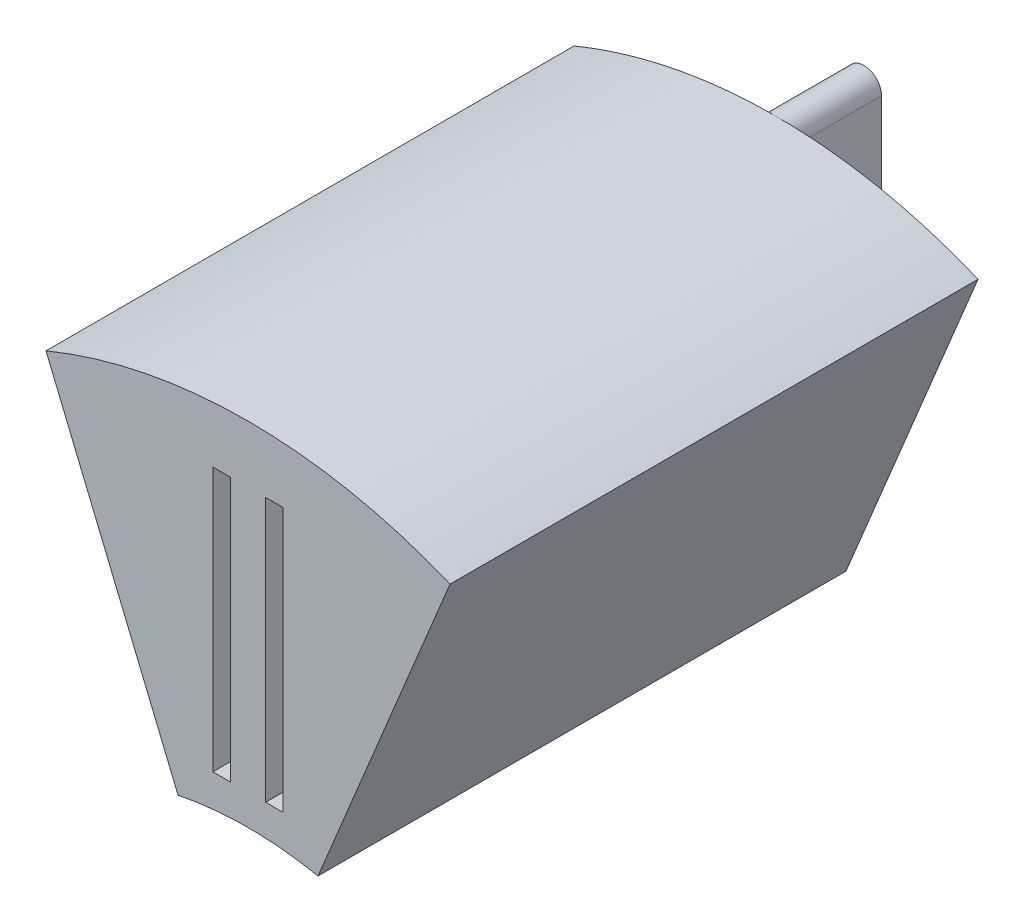
from build123d import *

# Parameters (mm, degrees)
BOSS_EXTRUDE1_DEPTH     = 3
BOSS_EXTRUDE2_DEPTH     = 0.5
CUT_EXTRUDE1_DEPTH      = 0.1
CUT_EXTRUDE1_DEPTH_BACK = 0.3
SKETCH5_W               = 0.2
SKETCH5_H               = 1.5
BOSS_EXTRUDE3_DEPTH     = 3
BOSS_EXTRUDE4_START     = 0.5
BOSS_EXTRUDE4_DEPTH     = 0.5
SKETCH7_R               = 2
CUT_EXTRUDE2_DEPTH      = 3
SKETCH8_W               = 2.825057403
SKETCH8_H               = 1.13922334
CUT_EXTRUDE3_DEPTH      = 0.5
SKETCH9_W               = 2.979299044
SKETCH9_H               = 1.350290847
CUT_EXTRUDE4_DEPTH      = 0.5
SKETCH10_W              = 0.979929186
SKETCH10_H              = 2.841384628
CUT_EXTRUDE5_DEPTH      = 2


with BuildPart() as part:
    # Sketch1 → Boss-Extrude1 (new body)
    with BuildSketch(Plane.XY):
        with BuildLine():
            Line((1.148050297, 2.771638598), (0.382683432, 0.923879533))
            ThreePointArc((0.382683432, 0.923879533), (0, 1), (-0.382683432, 0.923879533))
            Line((-0.382683432, 0.923879533), (-1.148050297, 2.771638598))
            ThreePointArc((-1.148050297, 2.771638598), (0, 3), (1.148050297, 2.771638598))
        make_face()
    extrude(amount=BOSS_EXTRUDE1_DEPTH)

    # Sketch2 → Boss-Extrude2 (add)
    with BuildSketch(Plane.XY.offset(3)):
        with BuildLine():
            Line((-0.1, 2), (-0.1, 2.9))
            ThreePointArc((-0.1, 2.9), (0, 3), (0.1, 2.9))
            Line((0.1, 2.9), (0.1, 2))
            ThreePointArc((0.1, 2), (0, 1.9), (-0.1, 2))
        make_face()
    extrude(amount=BOSS_EXTRUDE2_DEPTH)

    # Sketch4 → Cut-Extrude1 (cut, two sides: drawn at the far end of the back side and taken through both)
    with BuildSketch(Plane(origin=(0.1, 0, 0), x_dir=(0, 0, -1), z_dir=(1, 0, 0)).offset(-CUT_EXTRUDE1_DEPTH_BACK)):
        Polygon((-3, 2.673879533), (-3, 1.173879533), (-1, 1.173879533), align=None)
    extrude(amount=CUT_EXTRUDE1_DEPTH + CUT_EXTRUDE1_DEPTH_BACK, mode=Mode.SUBTRACT)

    # Sketch5 → Boss-Extrude3 (add)
    with BuildSketch(Plane.XY.offset(3)):
        with Locations((0, 1.923879533)):
            Rectangle(SKETCH5_W, SKETCH5_H)
    extrude(amount=-BOSS_EXTRUDE3_DEPTH)

    # Sketch6 → Boss-Extrude4 (add)
    with BuildSketch(Plane(origin=(0, 0, 0), x_dir=(-1, 0, 0), z_dir=(0, 0, -1)).offset(BOSS_EXTRUDE4_START)):
        with BuildLine():
            Line((-0.1, 2), (-0.1, 2.9))
            ThreePointArc((-0.1, 2.9), (0, 3), (0.1, 2.9))
            Line((0.1, 2.9), (0.1, 2))
            ThreePointArc((0.1, 2), (0, 1.9), (-0.1, 2))
        make_face()
    extrude(amount=-BOSS_EXTRUDE4_DEPTH)

    # Sketch7 → Cut-Extrude2 (cut)
    with BuildSketch(Plane.XY.offset(3)):
        with Locations((0, -1)):
            Circle(SKETCH7_R)
    extrude(amount=-CUT_EXTRUDE2_DEPTH, mode=Mode.SUBTRACT)

    # Sketch8 → Cut-Extrude3 (cut)
    with BuildSketch(Plane.XY.offset(3.5)):
        with Locations((0.108239748, 1.43038833)):
            Rectangle(SKETCH8_W, SKETCH8_H)
    extrude(amount=-CUT_EXTRUDE3_DEPTH, mode=Mode.SUBTRACT)

    # Sketch9 → Cut-Extrude4 (cut)
    with BuildSketch(Plane(origin=(0, 0, -0.5), x_dir=(-1, 0, 0), z_dir=(0, 0, -1))):
        with Locations((-0.058178864, 1.324854576)):
            Rectangle(SKETCH9_W, SKETCH9_H)
    extrude(amount=-CUT_EXTRUDE4_DEPTH, mode=Mode.SUBTRACT)

    # Sketch10 → Cut-Extrude5 (cut)
    with BuildSketch(Plane(origin=(0.1, 0, 0), x_dir=(0, 0, -1), z_dir=(1, 0, 0))):
        with Locations((-3.489964593, 2.117386852)):
            Rectangle(SKETCH10_W, SKETCH10_H)
    extrude(amount=-CUT_EXTRUDE5_DEPTH, mode=Mode.SUBTRACT)


solid = part.part
